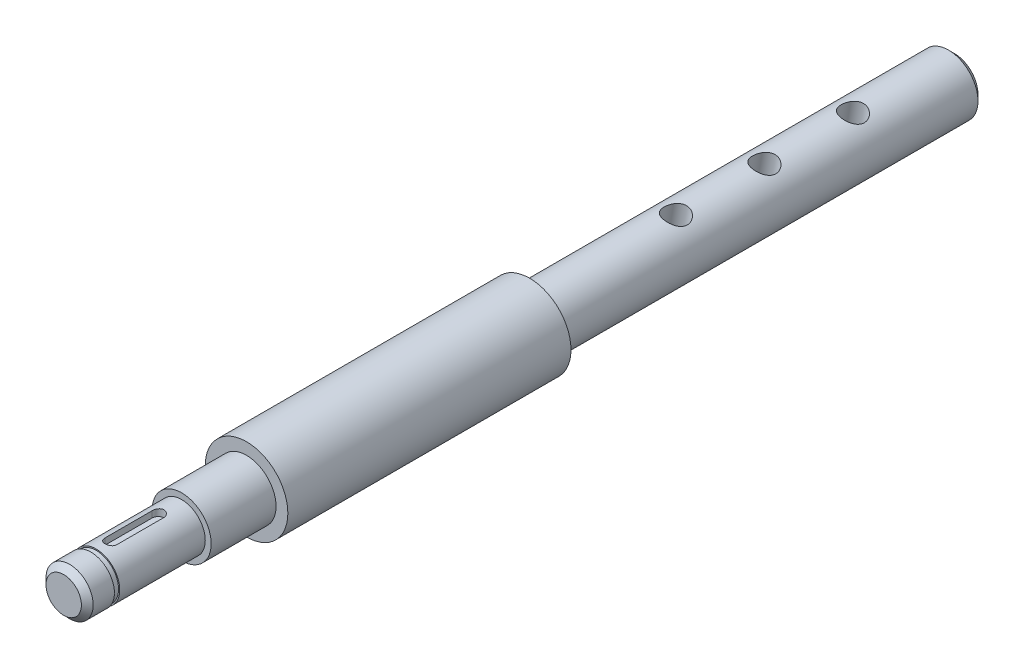
from build123d import *

# Parameters (mm, degrees)
SKETCH1_R           = 5
BOSS_EXTRUDE1_DEPTH = 136
SKETCH2_R           = 4
BOSS_EXTRUDE2_DEPTH = 20
CUT_EXTRUDE1_DEPTH  = 1.2
SKETCH4_W           = 0.55765723
SKETCH4_H           = 0.9
CHAMFER1_SIZE       = 1
SKETCH6_R           = 7
BOSS_EXTRUDE3_DEPTH = 48
CUT_EXTRUDE3_REACH  = 159.949
SKETCH7_R           = 2
SKETCH8_R           = 5
CUT_EXTRUDE4_DEPTH  = 5
CHAMFER2_SIZE       = 1


with BuildPart() as part:
    # Sketch1 → Boss-Extrude1 (new body)
    with BuildSketch(Plane.XY):
        Circle(SKETCH1_R)
    extrude(amount=BOSS_EXTRUDE1_DEPTH)

    # Sketch2 → Boss-Extrude2 (add)
    with BuildSketch(Plane.XY.offset(136)):
        Circle(SKETCH2_R)
    extrude(amount=BOSS_EXTRUDE2_DEPTH)

    # Sketch3 → Cut-Extrude1 (cut)
    with BuildSketch(Plane(origin=(0, 4, 0), x_dir=(1, 0, 0), z_dir=(0, 1, 0))):
        with BuildLine():
            Line((-1, -148), (-1, -140))
            ThreePointArc((-1, -140), (0, -139), (1, -140))
            Line((1, -140), (1, -148))
            ThreePointArc((1, -148), (0, -149), (-1, -148))
        make_face()
    extrude(amount=-CUT_EXTRUDE1_DEPTH, mode=Mode.SUBTRACT)

    # Sketch4 → Cut-Revolve1 (revolve, cut)
    with BuildSketch(Plane(origin=(0, 0, 0), x_dir=(1, 0, 0), z_dir=(0, 1, 0))):
        with Locations((-4.078828615, -150.95)):
            Rectangle(SKETCH4_W, SKETCH4_H)
    revolve(axis=Axis((0, 0, -16.531983683), (0, 0, 1)), mode=Mode.SUBTRACT)

    # Chamfer1
    chamfer1_edges = [part.edges().sort_by_distance(p)[0] for p in [
        (-4, 0, 156),
    ]]
    chamfer(chamfer1_edges, length=CHAMFER1_SIZE)

    # Sketch6 → Boss-Extrude3 (add)
    with BuildSketch(Plane.XY.offset(77)):
        Circle(SKETCH6_R)
    extrude(amount=BOSS_EXTRUDE3_DEPTH)

    # Sketch7 → Cut-Extrude3 (cut, up to next)
    with BuildSketch(Plane(origin=(-2.642522108, -15.780274931, 0), x_dir=(0, 0, 1), z_dir=(-0.16515763172219566, -0.9862671832135123, -1.0705486064346984e-15)), mode=Mode.PRIVATE) as cut_extrude3_sk1:
        with Locations((53, 0)):
            Circle(SKETCH7_R)
    cut_extrude3_tool1 = extrude(cut_extrude3_sk1.sketch, amount=-CUT_EXTRUDE3_REACH, mode=Mode.PRIVATE) & part.part
    # Sketch7 → Cut-Extrude3 (cut, up to next)
    with BuildSketch(Plane(origin=(-2.642522108, -15.780274931, 0), x_dir=(0, 0, 1), z_dir=(-0.16515763172219566, -0.9862671832135123, -1.0705486064346984e-15)), mode=Mode.PRIVATE) as cut_extrude3_sk2:
        with Locations((38, 0)):
            Circle(SKETCH7_R)
    cut_extrude3_tool2 = extrude(cut_extrude3_sk2.sketch, amount=-CUT_EXTRUDE3_REACH, mode=Mode.PRIVATE) & part.part
    # Sketch7 → Cut-Extrude3 (cut, up to next)
    with BuildSketch(Plane(origin=(-2.642522108, -15.780274931, 0), x_dir=(0, 0, 1), z_dir=(-0.16515763172219566, -0.9862671832135123, -1.0705486064346984e-15)), mode=Mode.PRIVATE) as cut_extrude3_sk3:
        with Locations((23, 0)):
            Circle(SKETCH7_R)
    cut_extrude3_tool3 = extrude(cut_extrude3_sk3.sketch, amount=-CUT_EXTRUDE3_REACH, mode=Mode.PRIVATE) & part.part
    add(cut_extrude3_tool1.solids().sort_by_distance((-2.642522, -15.780275, 53))[0], mode=Mode.SUBTRACT)
    add(cut_extrude3_tool2.solids().sort_by_distance((-2.642522, -15.780275, 38))[0], mode=Mode.SUBTRACT)
    add(cut_extrude3_tool3.solids().sort_by_distance((-2.642522, -15.780275, 23))[0], mode=Mode.SUBTRACT)

    # Sketch8 → Cut-Extrude4 (cut)
    with BuildSketch(Plane(origin=(0, 0, 0), x_dir=(-1, 0, 0), z_dir=(0, 0, -1))):
        Circle(SKETCH8_R)
    extrude(amount=-CUT_EXTRUDE4_DEPTH, mode=Mode.SUBTRACT)

    # Chamfer2
    chamfer2_edges = [part.edges().sort_by_distance(p)[0] for p in [
        (-5, 0, 5),
    ]]
    chamfer(chamfer2_edges, length=CHAMFER2_SIZE)


solid = part.part
